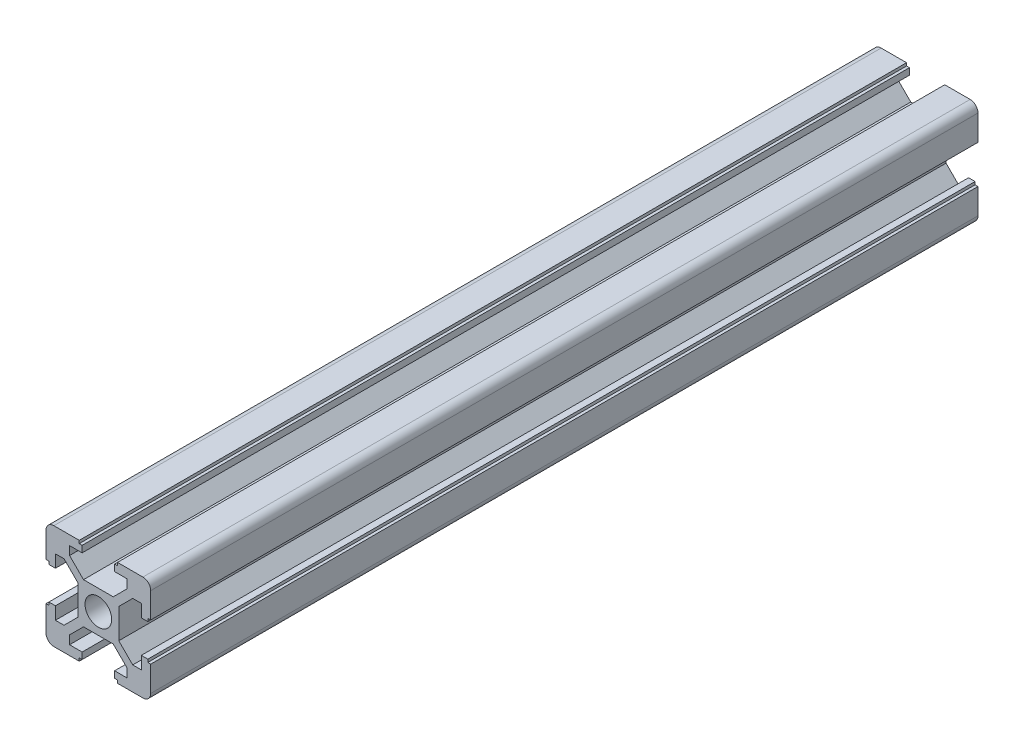
from build123d import *

# Parameters (mm, degrees)
SKETCH_2_R      = 2.55
EXTRUDE_1_DEPTH = 158


with BuildPart() as part:
    # 草图2 → 凸台-拉伸1 (new body)
    with BuildSketch(Plane.XY):
        with BuildLine():
            Line((-3.9, 2.839339828), (-6.560660172, 5.5))
            Line((-6.560660172, 5.5), (-8.2, 5.5))
            Line((-8.2, 5.5), (-8.2, 3.1))
            Line((-8.2, 3.1), (-9.45, 3.1))
            Line((-9.45, 3.1), (-9.45, 3.65))
            Line((-9.45, 3.65), (-10, 3.65))
            Line((-10, 3.65), (-10, 8.5))
            ThreePointArc((-10, 8.5), (-9.560660172, 9.560660172), (-8.5, 10))
            Line((-8.5, 10), (-3.65, 10))
            Line((-3.65, 10), (-3.65, 9.45))
            Line((-3.65, 9.45), (-3.1, 9.45))
            Line((-3.1, 9.45), (-3.1, 8.2))
            Line((-3.1, 8.2), (-5.5, 8.2))
            Line((-5.5, 8.2), (-5.5, 6.560660172))
            Line((-5.5, 6.560660172), (-2.839339828, 3.9))
            Line((-2.839339828, 3.9), (2.839339828, 3.9))
            Line((2.839339828, 3.9), (5.5, 6.560660172))
            Line((5.5, 6.560660172), (5.5, 8.2))
            Line((5.5, 8.2), (3.1, 8.2))
            Line((3.1, 8.2), (3.1, 9.45))
            Line((3.1, 9.45), (3.65, 9.45))
            Line((3.65, 9.45), (3.65, 10))
            Line((3.65, 10), (8.5, 10))
            ThreePointArc((8.5, 10), (9.560660172, 9.560660172), (10, 8.5))
            Line((10, 8.5), (10, 3.65))
            Line((10, 3.65), (9.45, 3.65))
            Line((9.45, 3.65), (9.45, 3.1))
            Line((9.45, 3.1), (8.2, 3.1))
            Line((8.2, 3.1), (8.2, 5.5))
            Line((8.2, 5.5), (6.560660172, 5.5))
            Line((6.560660172, 5.5), (3.9, 2.839339828))
            Line((3.9, 2.839339828), (3.9, -2.839339828))
            Line((3.9, -2.839339828), (6.560660172, -5.5))
            Line((6.560660172, -5.5), (8.2, -5.5))
            Line((8.2, -5.5), (8.2, -3.1))
            Line((8.2, -3.1), (9.45, -3.1))
            Line((9.45, -3.1), (9.45, -3.65))
            Line((9.45, -3.65), (10, -3.65))
            Line((10, -3.65), (10, -8.5))
            ThreePointArc((10, -8.5), (9.560660172, -9.560660172), (8.5, -10))
            Line((8.5, -10), (3.65, -10))
            Line((3.65, -10), (3.65, -9.45))
            Line((3.65, -9.45), (3.1, -9.45))
            Line((3.1, -9.45), (3.1, -8.2))
            Line((3.1, -8.2), (5.5, -8.2))
            Line((5.5, -8.2), (5.5, -6.560660172))
            Line((5.5, -6.560660172), (2.839339828, -3.9))
            Line((2.839339828, -3.9), (-2.839339828, -3.9))
            Line((-2.839339828, -3.9), (-5.5, -6.560660172))
            Line((-5.5, -6.560660172), (-5.5, -8.2))
            Line((-5.5, -8.2), (-3.1, -8.2))
            Line((-3.1, -8.2), (-3.1, -9.45))
            Line((-3.1, -9.45), (-3.65, -9.45))
            Line((-3.65, -9.45), (-3.65, -10))
            Line((-3.65, -10), (-8.5, -10))
            ThreePointArc((-8.5, -10), (-9.560660172, -9.560660172), (-10, -8.5))
            Line((-10, -8.5), (-10, -3.65))
            Line((-10, -3.65), (-9.45, -3.65))
            Line((-9.45, -3.65), (-9.45, -3.1))
            Line((-9.45, -3.1), (-8.2, -3.1))
            Line((-8.2, -3.1), (-8.2, -5.5))
            Line((-8.2, -5.5), (-6.560660172, -5.5))
            Line((-6.560660172, -5.5), (-3.9, -2.839339828))
            Line((-3.9, -2.839339828), (-3.9, 2.839339828))
        make_face()
        Circle(SKETCH_2_R, mode=Mode.SUBTRACT)
    extrude(amount=EXTRUDE_1_DEPTH)


solid = part.part
